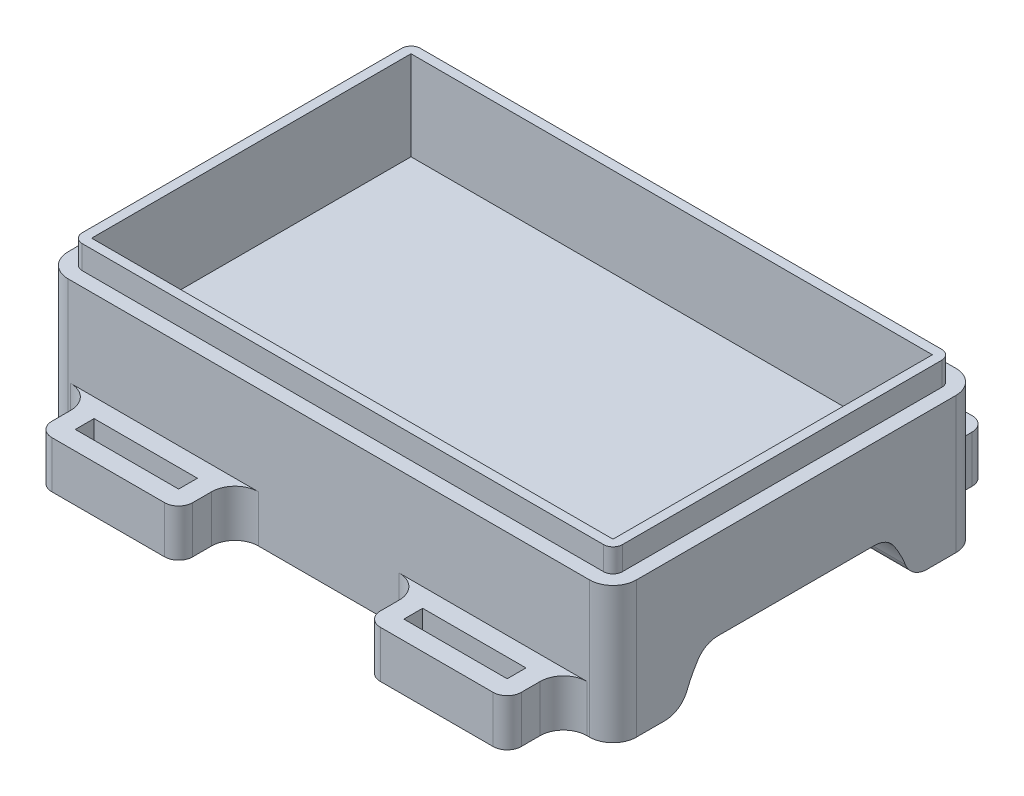
from build123d import *

# Parameters (mm, degrees)
CROQUIS2_W                   = 121
CROQUIS2_H                   = 78
CROQUIS2_W_2                 = 111
CROQUIS2_H_2                 = 68
SALIENTE_EXTRUIR2_DEPTH      = 19
CROQUIS4_W                   = 121
CROQUIS4_H                   = 78
SALIENTE_EXTRUIR3_DEPTH      = 5
SALIENTE_EXTRUIR4_DEPTH      = 60.5
SALIENTE_EXTRUIR4_DEPTH_BACK = 60.5
REDONDEO2_R                  = 5
CROQUIS7_W                   = 30
CROQUIS7_H                   = 12
CROQUIS7_W_2                 = 22
CROQUIS7_H_2                 = 4
SALIENTE_EXTRUIR5_DEPTH      = 10
REDONDEO5_R                  = 3
REDONDEO8_R                  = 5
REDONDEO6_R                  = 5
CROQUIS8_OUTSIDE_W           = 155.374
CROQUIS8_OUTSIDE_H           = 136.374
CORTAR_EXTRUIR1_DEPTH        = 5


with BuildPart() as part:
    # Croquis2 → Saliente-Extruir2 (new body)
    with BuildSketch(Plane(origin=(0, 0, 0), x_dir=(1, 0, 0), z_dir=(0, 1, 0))):
        Rectangle(CROQUIS2_W, CROQUIS2_H)
        Rectangle(CROQUIS2_W_2, CROQUIS2_H_2, mode=Mode.SUBTRACT)
    extrude(amount=-SALIENTE_EXTRUIR2_DEPTH)

    # Croquis4 → Saliente-Extruir3 (add)
    with BuildSketch(Plane.XZ.offset(19)):
        Rectangle(CROQUIS4_W, CROQUIS4_H)
    extrude(amount=SALIENTE_EXTRUIR3_DEPTH)

    # Croquis6 → Saliente-Extruir4 (add, two sides: drawn at the far end of the back side and taken through both)
    with BuildSketch(Plane(origin=(0, 0, 0), x_dir=(0, 0, -1), z_dir=(1, 0, 0)).offset(-SALIENTE_EXTRUIR4_DEPTH_BACK)):
        with BuildLine():
            Line((-39, -24), (-19.209372712, -24))
            ThreePointArc((-19.209372712, -24), (-22.306932281, -28.712804945), (-24.269322199, -34))
            Line((-24.269322199, -34), (-39, -34))
            Line((-39, -34), (-39, -24))
        make_face()
        with BuildLine():
            Line((39, -24), (39, -34))
            Line((39, -34), (24.269322199, -34))
            ThreePointArc((24.269322199, -34), (22.306932281, -28.712804945), (19.209372712, -24))
            Line((19.209372712, -24), (39, -24))
        make_face()
    extrude(amount=SALIENTE_EXTRUIR4_DEPTH + SALIENTE_EXTRUIR4_DEPTH_BACK)

    # Redondeo2
    redondeo2_edges = [part.edges().sort_by_distance(p)[0] for p in [
        (0, -34, 24.269322199),
        (0, -24, 19.209372712),
        (0, -34, -24.269322199),
        (0, -24, -19.209372712),
    ]]
    fillet(redondeo2_edges, radius=REDONDEO2_R)

    # Croquis7 → Saliente-Extruir5 (add)
    # profile 1 of 4: a face of its own
    with BuildSketch(Plane.XZ.offset(24)):
        with Locations((-34.974984355, 45)):
            Rectangle(CROQUIS7_W, CROQUIS7_H)
        with Locations((-34.974984355, 45)):
            Rectangle(CROQUIS7_W_2, CROQUIS7_H_2, mode=Mode.SUBTRACT)
    # profile 2 of 4: a face of its own
    with BuildSketch(Plane.XZ.offset(24)):
        with Locations((-34.974984355, -45)):
            Rectangle(CROQUIS7_W, CROQUIS7_H)
        with Locations((-34.974984355, -45)):
            Rectangle(CROQUIS7_W_2, CROQUIS7_H_2, mode=Mode.SUBTRACT)
    # profile 3 of 4: a face of its own
    with BuildSketch(Plane.XZ.offset(24)):
        with Locations((34.974984355, -45)):
            Rectangle(CROQUIS7_W, CROQUIS7_H)
        with Locations((34.974984355, -45)):
            Rectangle(CROQUIS7_W_2, CROQUIS7_H_2, mode=Mode.SUBTRACT)
    # profile 4 of 4: a face of its own
    with BuildSketch(Plane.XZ.offset(24)):
        with Locations((34.974984355, 45)):
            Rectangle(CROQUIS7_W, CROQUIS7_H)
        with Locations((34.974984355, 45)):
            Rectangle(CROQUIS7_W_2, CROQUIS7_H_2, mode=Mode.SUBTRACT)
    extrude(amount=SALIENTE_EXTRUIR5_DEPTH)

    # Redondeo5
    redondeo5_edges = [part.edges().sort_by_distance(p)[0] for p in [
        (-49.974984355, -29, 51),
        (-19.974984355, -29, 51),
        (-49.974984355, -29, -51),
        (-19.974984355, -29, -51),
        (19.974984355, -29, -51),
        (49.974984355, -29, -51),
        (49.974984355, -29, 51),
        (19.974984355, -29, 51),
    ]]
    fillet(redondeo5_edges, radius=REDONDEO5_R)

    # Redondeo8
    redondeo8_edges = [part.edges().sort_by_distance(p)[0] for p in [
        (60.5, -17, 39),
        (-60.5, -17, 39),
        (-60.5, -17, -39),
        (60.5, -17, -39),
    ]]
    fillet(redondeo8_edges, radius=REDONDEO8_R)

    # Redondeo6
    redondeo6_edges = [part.edges().sort_by_distance(p)[0] for p in [
        (-49.974984355, -29, 39),
        (-19.974984355, -29, 39),
        (-49.974984355, -29, -39),
        (-19.974984355, -29, -39),
        (49.974984355, -29, -39),
        (19.974984355, -29, -39),
        (49.974984355, -29, 39),
        (19.974984355, -29, 39),
    ]]
    fillet(redondeo6_edges, radius=REDONDEO6_R)

    # Croquis8 outside → Cortar-Extruir1 (cut)
    with BuildSketch(Plane(origin=(0, 0, 0), x_dir=(1, 0, 0), z_dir=(0, 1, 0))):
        Rectangle(CROQUIS8_OUTSIDE_W, CROQUIS8_OUTSIDE_H)
        with BuildLine():
            Line((55.5, 36), (-55.5, 36))
            ThreePointArc((-55.5, 36), (-56.914213562, 35.414213562), (-57.5, 34))
            Line((-57.5, 34), (-57.5, -34))
            ThreePointArc((-57.5, -34), (-56.914213562, -35.414213562), (-55.5, -36))
            Line((-55.5, -36), (55.5, -36))
            ThreePointArc((55.5, -36), (56.914213562, -35.414213562), (57.5, -34))
            Line((57.5, -34), (57.5, 34))
            ThreePointArc((57.5, 34), (56.914213562, 35.414213562), (55.5, 36))
        make_face(mode=Mode.SUBTRACT)
    extrude(amount=-CORTAR_EXTRUIR1_DEPTH, mode=Mode.SUBTRACT)


solid = part.part
